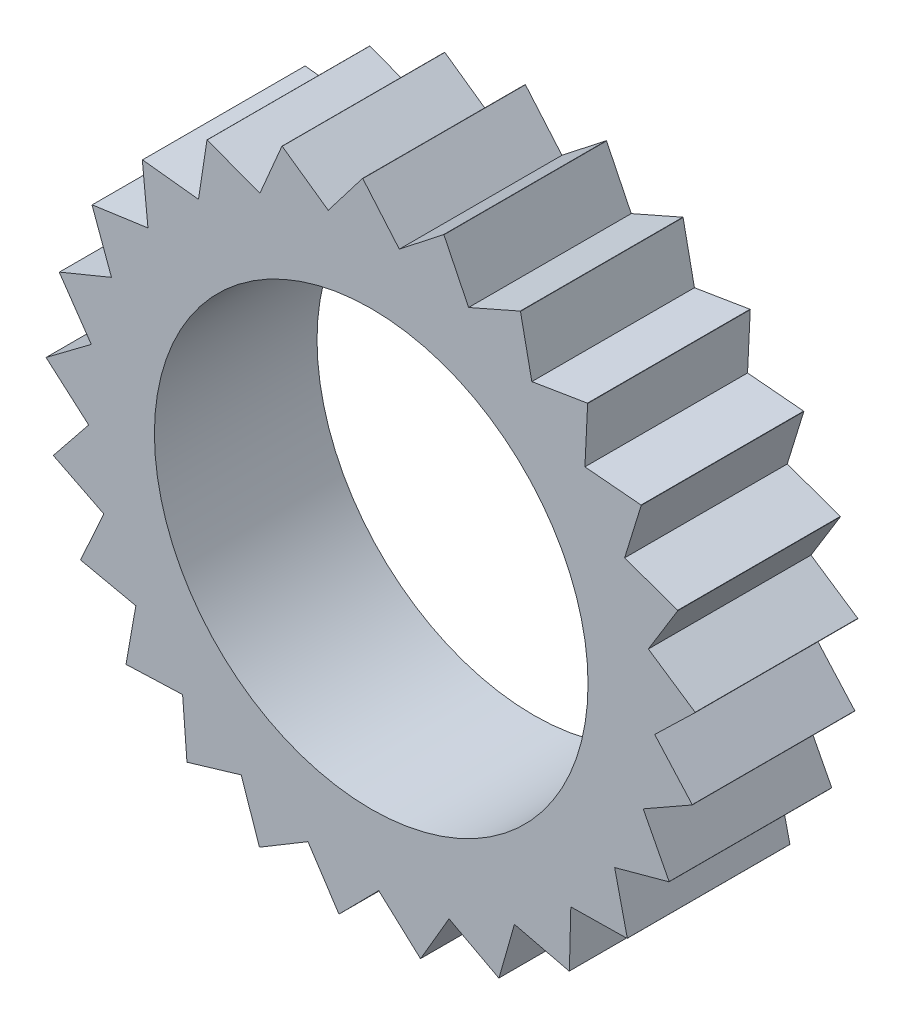
from build123d import *

# Parameters (mm, degrees)
ESQUISSE1_R                  = 6
ESQUISSE1_R_2                = 4
BOSS_EXTRU_1_DEPTH           = 3
ENL_V_START                  = -3
ENL_V_MAT_EXTRU_1_DEPTH      = 3
R_P_TITION_CIRCULAIRE1_COUNT = 25


with BuildPart() as part:
    # Esquisse1 → Boss.-Extru.1 (new body)
    with BuildSketch(Plane.XY):
        Circle(ESQUISSE1_R)
        Circle(ESQUISSE1_R_2, mode=Mode.SUBTRACT)
    extrude(amount=BOSS_EXTRU_1_DEPTH)

    # Esquisse2 → Enlèv. mat.-Extru.1 (cut)
    with BuildSketch(Plane.XY.offset(3).offset(ENL_V_START)):
        with BuildLine():
            Line((-1.642379627, 5.770839554), (-1.642202224, 5.770714571))
            Line((-1.642202224, 5.770714571), (-0.793081387, 5.17249337))
            Line((-0.793081387, 5.17249337), (-0.160864862, 5.997843154))
            ThreePointArc((-0.160864862, 5.997843154), (-0.908738318, 5.930783647), (-1.642379627, 5.770839554))
        make_face()
    enl_v_mat_extru_1 = extrude(amount=ENL_V_MAT_EXTRU_1_DEPTH, mode=Mode.SUBTRACT)

    # Répétition circulaire1: Enlèv. mat.-Extru.1 ×25 about axis
    r_p_tition_circulaire1_axis = Axis((0, 0, 0), (0, 0, 1))
    for i in range(1, R_P_TITION_CIRCULAIRE1_COUNT):
        add(enl_v_mat_extru_1.rotate(r_p_tition_circulaire1_axis, i * 360 / R_P_TITION_CIRCULAIRE1_COUNT), mode=Mode.SUBTRACT)


solid = part.part
